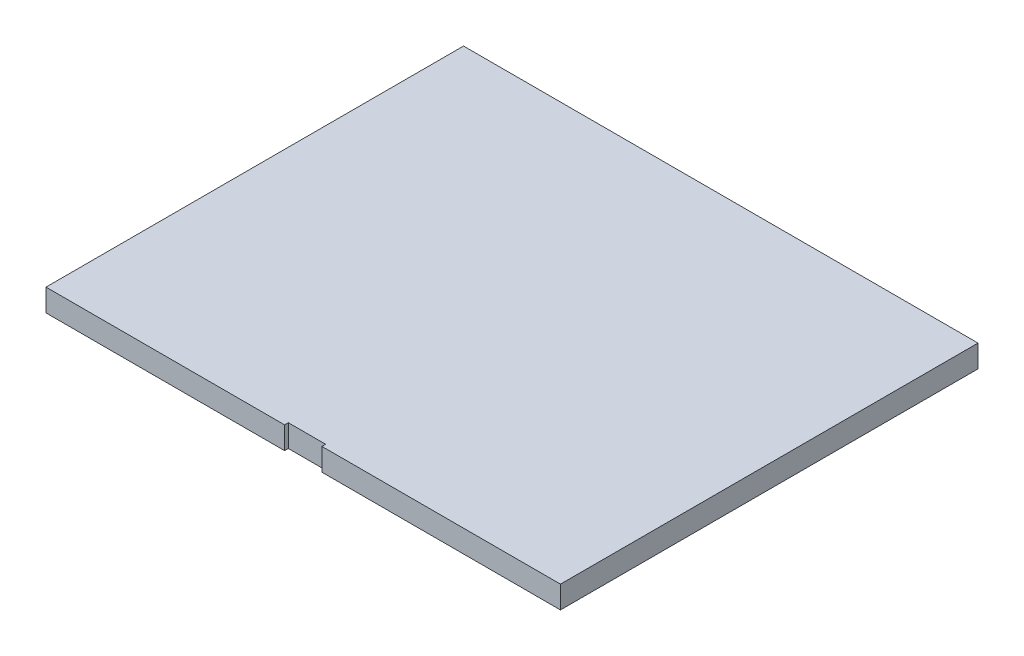
from build123d import *

# Parameters (mm, degrees)
SKETCH1_W           = 438.15
SKETCH1_H           = 355.6
BOSS_EXTRUDE1_DEPTH = 19.05
SKETCH2_W           = 31.75
SKETCH2_H           = 3.175
CUT_EXTRUDE1_DEPTH  = 565.614634065


with BuildPart() as part:
    # Sketch1 → Boss-Extrude1 (new body)
    with BuildSketch(Plane(origin=(0, 0, 0), x_dir=(1, 0, 0), z_dir=(0, 1, 0))):
        with Locations((219.075, 177.8)):
            Rectangle(SKETCH1_W, SKETCH1_H)
    extrude(amount=BOSS_EXTRUDE1_DEPTH)

    # Sketch2 → Cut-Extrude1 (cut, through all)
    with BuildSketch(Plane(origin=(0, 19.05, 0), x_dir=(1, 0, 0), z_dir=(0, 1, 0))):
        with Locations((219.075, 1.5875)):
            Rectangle(SKETCH2_W, SKETCH2_H)
    extrude(amount=-CUT_EXTRUDE1_DEPTH, mode=Mode.SUBTRACT)


solid = part.part
